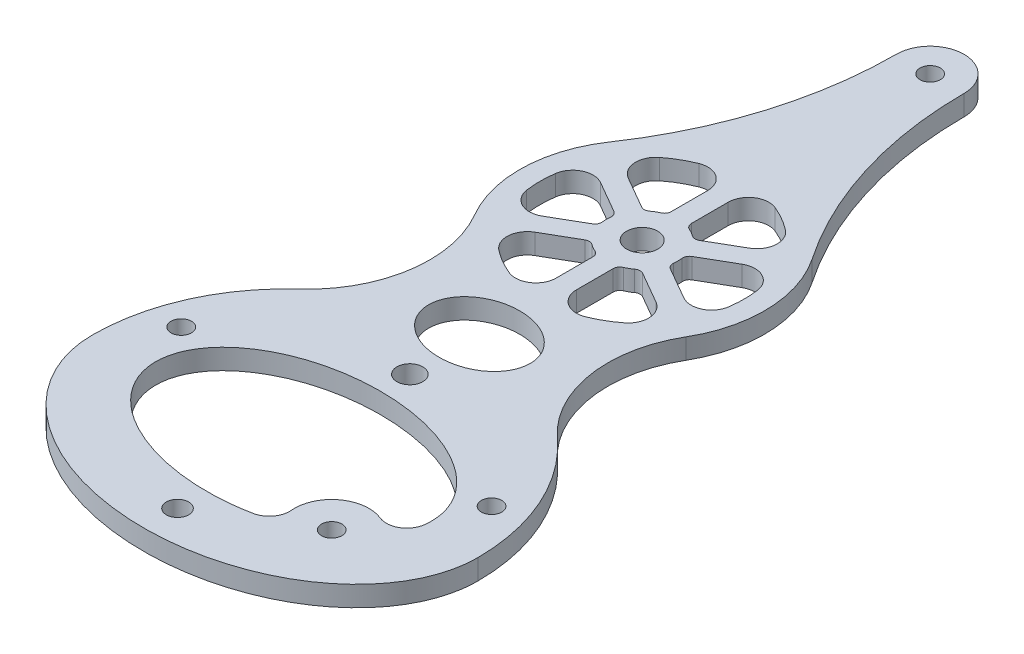
from build123d import *

# Parameters (mm, degrees)
SKETCH1_R                = 1.5
SKETCH1_R_2              = 2.3
SKETCH1_R_3              = 1.65
SKETCH1_R_4              = 1.909188309
SKETCH1_RX               = 20.362751378
SKETCH1_RY               = 12.812950259
SKETCH1_RX_2             = 7.5
SKETCH1_RY_2             = 5.944828068
BOSS_EXTRUDE1_DEPTH      = 3
SKETCH2_R                = 5.5
BOSS_EXTRUDE2_DEPTH      = 3
FILLET1_R                = 3
SKETCH3_R                = 1.5
CUT_EXTRUDE1_DEPTH       = 79.921363197
CUT_EXTRUDE2_DEPTH       = 79.921363197
FILLET2_R                = 3
FILLET3_R                = 1
CIRPATTERN1_COUNT        = 6
FILLET2_OF_CIRPATTERN1_R = 3
FILLET3_OF_CIRPATTERN1_R = 1


with BuildPart() as part:
    # Sketch1 → Boss-Extrude1 (new body)
    with BuildSketch(Plane(origin=(0, 0, 0), x_dir=(1, 0, 0), z_dir=(0, 1, 0))):
        with BuildLine():
            ThreePointArc((-14.944034973, 10.145236258), (-18.051873862, 0.616319792), (-15.601179111, -9.102373886))
            ThreePointArc((-15.601179111, -9.102373886), (-13.352587893, -20.968024673), (-19.083723838, -31.598354482))
            ThreePointArc((-19.083723838, -31.598354482), (-25.998546823, -41.152307046), (-28.443609023, -52.689830928))
            add(Edge.make_bspline(
                [(-28.443609023, -52.689830928), (-28.443609023, -73.556390977), (0, -73.556390977), (28.443609023, -73.556390977), (28.443609023, -52.689830928)],
                knots=[0, 0, 0, 1.570796327, 1.570796327, 3.141592654, 3.141592654, 3.141592654], degree=2, weights=[1, 0.707106781, 1, 0.707106781, 1]))
            ThreePointArc((28.443609023, -52.689830928), (25.998546823, -41.152307046), (19.083723838, -31.598354482))
            ThreePointArc((19.083723838, -31.598354482), (13.352587893, -20.968024673), (15.601179111, -9.102373886))
            ThreePointArc((15.601179111, -9.102373886), (18.051873862, 0.616319792), (14.944034973, 10.145236258))
            ThreePointArc((14.944034973, 10.145236258), (7.542106487, 25.574270902), (5, 42.497076519))
            ThreePointArc((5, 42.497076519), (0, 47.497076519), (-5, 42.497076519))
            ThreePointArc((-5, 42.497076519), (-7.542106487, 25.574270902), (-14.944034973, 10.145236258))
        make_face()
        with Locations(Location((22.896149501, -45.11234526, 0), (0, 0, 270))):
            Circle(SKETCH1_R, mode=Mode.SUBTRACT)
        with Locations(Location((-22.896149501, -45.11234526, 0), (0, 0, 270))):
            Circle(SKETCH1_R, mode=Mode.SUBTRACT)
        with Locations(Location((0, 0, 0), (0, 0, 270))):
            Circle(SKETCH1_R_2, mode=Mode.SUBTRACT)
        with Locations(Location((0, 42.497076519, 0), (0, 0, 270))):
            Circle(SKETCH1_R, mode=Mode.SUBTRACT)
        with Locations(Location((0, -68.556390977, 0), (0, 0, 270))):
            Circle(SKETCH1_R_3, mode=Mode.SUBTRACT)
        with Locations(Location((0, -34.278195489, 0), (0, 0, 270))):
            Circle(SKETCH1_R_4, mode=Mode.SUBTRACT)
        with Locations((0, -51.417293233)):
            Ellipse(SKETCH1_RX, SKETCH1_RY, mode=Mode.SUBTRACT)
        with Locations(Location((0, -24.007219936), (0, 0, -180))):
            Ellipse(SKETCH1_RX_2, SKETCH1_RY_2, mode=Mode.SUBTRACT)
    extrude(amount=BOSS_EXTRUDE1_DEPTH)

    # Sketch2 → Boss-Extrude2 (add)
    with BuildSketch(Plane.XZ):
        with Locations((14.120155711, 59.926468993)):
            Circle(SKETCH2_R)
    extrude(amount=-BOSS_EXTRUDE2_DEPTH)

    # Fillet1
    fillet1_edges = [part.edges().sort_by_distance(p)[0] for p in [
        (9.416956428, 1.5, 62.777769838),
        (18.562854805, 1.5, 56.684182029),
    ]]
    fillet(fillet1_edges, radius=FILLET1_R)

    # Sketch3 → Cut-Extrude1 (cut, through all)
    with BuildSketch(Plane(origin=(0, 3, 0), x_dir=(1, 0, 0), z_dir=(0, 1, 0))):
        with Locations(Location((14.120155711, -59.926468993, 0), (0, 0, 270))):
            Circle(SKETCH3_R)
    extrude(amount=-CUT_EXTRUDE1_DEPTH, mode=Mode.SUBTRACT)

    # Sketch4 → Cut-Extrude2 (cut, through all)
    with BuildSketch(Plane(origin=(0, 3, 0), x_dir=(1, 0, 0), z_dir=(0, 1, 0))):
        with BuildLine():
            Line((-1.5, -5.083306011), (-1.5, -14.987516432))
            ThreePointArc((-1.5, -14.987516432), (-7.531195934, -13.044414), (-12.229569969, -8.792796322))
            Line((-12.229569969, -8.792796322), (-3.652272141, -3.840691111))
            ThreePointArc((-3.652272141, -3.840691111), (-2.65, -4.58993464), (-1.5, -5.083306011))
        make_face()
    cut_extrude2 = extrude(amount=-CUT_EXTRUDE2_DEPTH, mode=Mode.SUBTRACT)

    # Fillet2
    fillet2_edges = [part.edges().sort_by_distance(p)[0] for p in [
        (-1.5, 1.5, 14.987516432),
        (-12.229569969, 1.5, 8.792796322),
    ]]
    fillet(fillet2_edges, radius=FILLET2_R)

    # Fillet3
    fillet3_edges = [part.edges().sort_by_distance(p)[0] for p in [
        (-3.652272141, 1.5, 3.840691111),
        (-1.5, 1.5, 5.083306011),
    ]]
    fillet(fillet3_edges, radius=FILLET3_R)

    # CirPattern1: Cut-Extrude2 ×6 about axis
    cirpattern1_axis = Axis((0, 0, 0), (0, 1, 0))
    for i in range(1, CIRPATTERN1_COUNT):
        add(cut_extrude2.rotate(cirpattern1_axis, i * 360 / CIRPATTERN1_COUNT), mode=Mode.SUBTRACT)

    # Fillet2 of CirPattern1
    fillet2_of_cirpattern1_edges = [part.edges().sort_by_distance(p)[0] for p in [
        (12.229569969, 1.5, 8.792796322),
        (1.5, 1.5, 14.987516432),
        (13.72956997, 1.5, -6.19472011),
        (13.72956997, 1.5, 6.19472011),
        (1.5, 1.5, -14.987516432),
        (12.229569969, 1.5, -8.792796322),
        (-12.229569969, 1.5, -8.792796322),
        (-1.5, 1.5, -14.987516432),
        (-13.72956997, 1.5, 6.19472011),
        (-13.72956997, 1.5, -6.19472011),
    ]]
    fillet(fillet2_of_cirpattern1_edges, radius=FILLET2_OF_CIRPATTERN1_R)

    # Fillet3 of CirPattern1
    fillet3_of_cirpattern1_edges = [part.edges().sort_by_distance(p)[0] for p in [
        (1.5, 1.5, 5.083306011),
        (3.652272141, 1.5, 3.840691111),
        (5.152272141, 1.5, 1.2426149),
        (5.152272141, 1.5, -1.2426149),
        (3.652272141, 1.5, -3.840691111),
        (1.5, 1.5, -5.083306011),
        (-1.5, 1.5, -5.083306011),
        (-3.652272141, 1.5, -3.840691111),
        (-5.152272141, 1.5, -1.2426149),
        (-5.152272141, 1.5, 1.2426149),
    ]]
    fillet(fillet3_of_cirpattern1_edges, radius=FILLET3_OF_CIRPATTERN1_R)


solid = part.part
